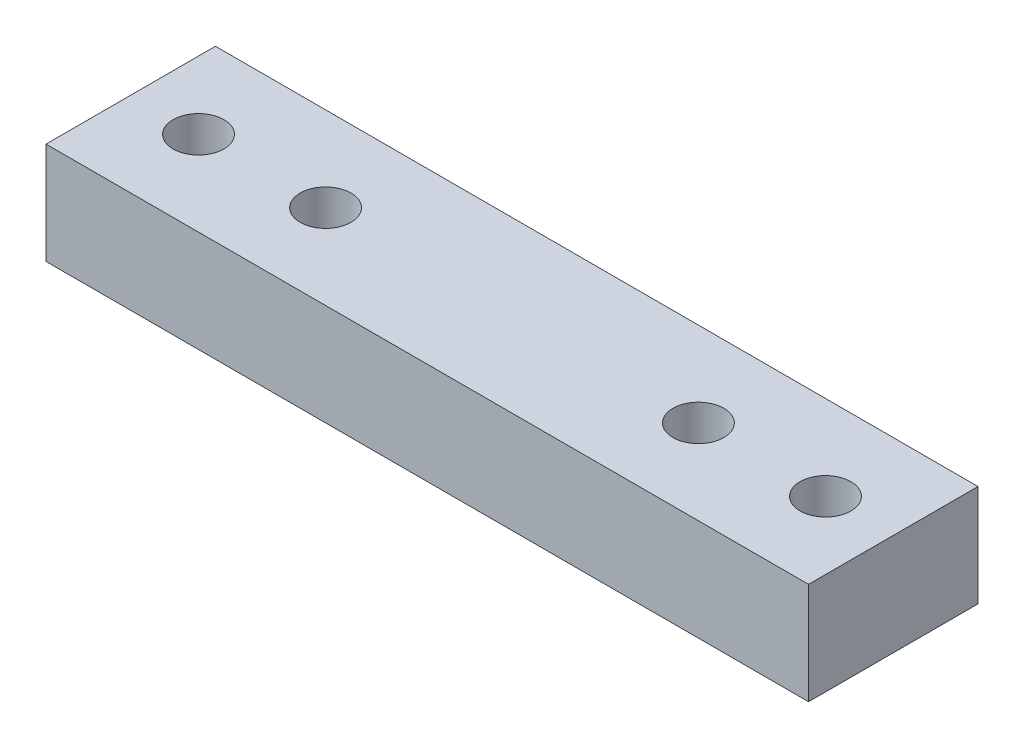
from build123d import *

# Parameters (mm, degrees)
SKETCH1_W           = 45
SKETCH1_H           = 10
SKETCH1_R           = 1.5
BOSS_EXTRUDE1_DEPTH = 6


with BuildPart() as part:
    # Sketch1 → Boss-Extrude1 (new body)
    with BuildSketch(Plane(origin=(0, 0, 0), x_dir=(1, 0, 0), z_dir=(0, 1, 0))):
        with Locations((3.903673105, 1.502320186)):
            Rectangle(SKETCH1_W, SKETCH1_H)
        with Locations(Location((-14.596326895, 1.502320186, 0), (0, 0, 270))):
            Circle(SKETCH1_R, mode=Mode.SUBTRACT)
        with Locations(Location((-7.096326895, 1.502320186, 0), (0, 0, 270))):
            Circle(SKETCH1_R, mode=Mode.SUBTRACT)
        with Locations(Location((22.403673105, 1.502320186, 0), (0, 0, 90))):
            Circle(SKETCH1_R, mode=Mode.SUBTRACT)
        with Locations(Location((14.903673105, 1.502320186, 0), (0, 0, 90))):
            Circle(SKETCH1_R, mode=Mode.SUBTRACT)
    extrude(amount=BOSS_EXTRUDE1_DEPTH)


solid = part.part
